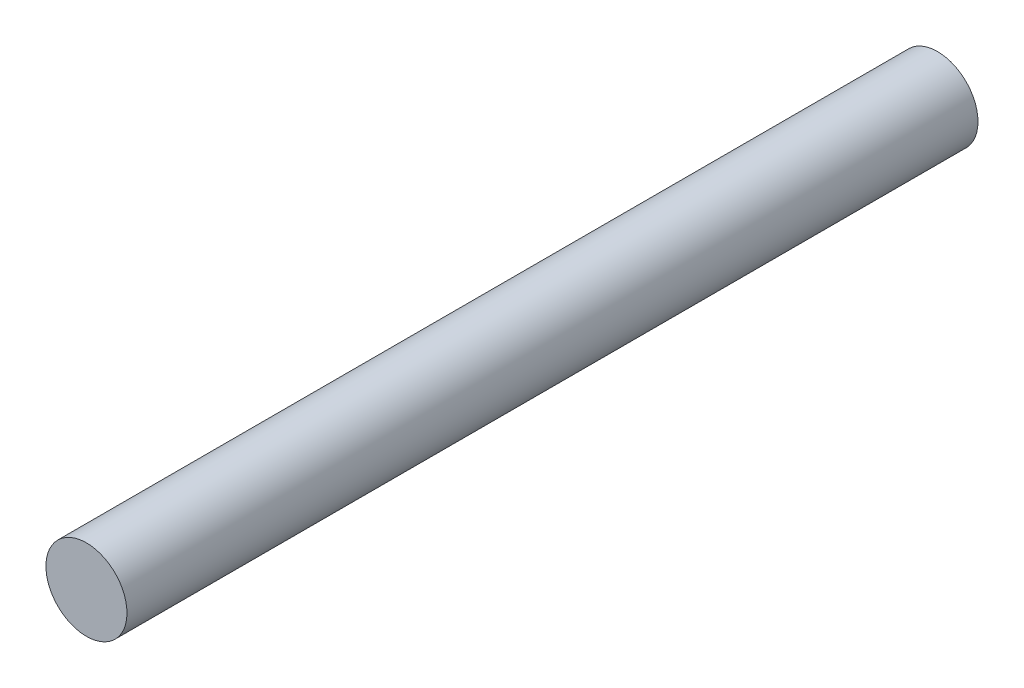
from build123d import *

# Parameters (mm, degrees)
SKETCH1_R           = 2.54
BOSS_EXTRUDE1_DEPTH = 53.34


with BuildPart() as part:
    # Sketch1 → Boss-Extrude1 (new body)
    with BuildSketch(Plane.XY):
        Circle(SKETCH1_R)
    extrude(amount=BOSS_EXTRUDE1_DEPTH)


solid = part.part
